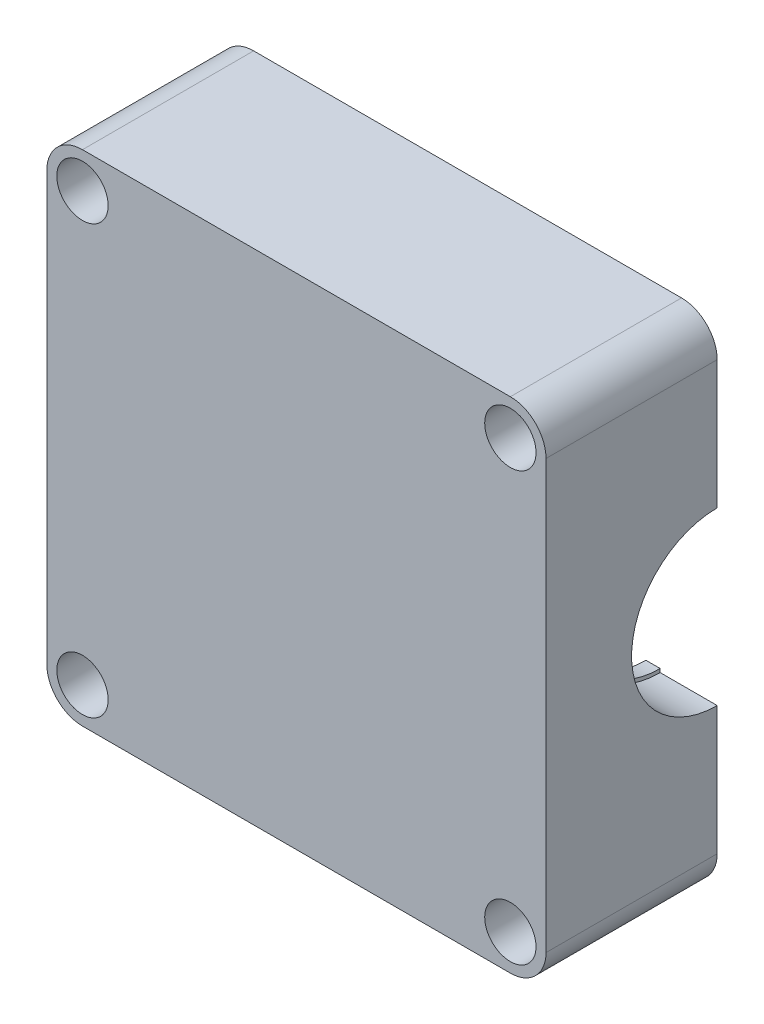
from build123d import *

# Parameters (mm, degrees)
SKETCH_1_R          = 1.8
EXTRUDE_1_DEPTH     = 42
SKETCH_2_R          = 6
CUT_EXTRUDE_1_DEPTH = 58.404268134
SKETCH_3_R          = 6
CUT_EXTRUDE_2_DEPTH = 58.404268134
CUT_EXTRUDE_3_DEPTH = 58.404268134
EXTRUDE_2_DEPTH     = 2.1
EXTRUDE_3_DEPTH     = 1
EXTRUDE_START       = -2
EXTRUDE_4_DEPTH     = 2
SKETCH_8_R          = 1.503070462
SKETCH_8_R_2        = 1.5
CUT_EXTRUDE_4_DEPTH = 3


with BuildPart() as part:
    # 草图1 → 凸台-拉伸1 (new body)
    with BuildSketch(Plane(origin=(0, 0, 0), x_dir=(-1, 0, 0), z_dir=(0, 0, 1))):
        with BuildLine():
            Line((-17.5, 15), (-17.5, -15))
            ThreePointArc((-17.5, -15), (-16.767766953, -16.767766953), (-15, -17.5))
            Line((-15, -17.5), (15, -17.5))
            ThreePointArc((15, -17.5), (16.767766953, -16.767766953), (17.5, -15))
            Line((17.5, -15), (17.5, 15))
            ThreePointArc((17.5, 15), (16.767766953, 16.767766953), (15, 17.5))
            Line((15, 17.5), (-15, 17.5))
            ThreePointArc((-15, 17.5), (-16.767766953, 16.767766953), (-17.5, 15))
        make_face()
        with Locations((-15, -15)):
            Circle(SKETCH_1_R, mode=Mode.SUBTRACT)
        with Locations((15, -15)):
            Circle(SKETCH_1_R, mode=Mode.SUBTRACT)
        with Locations((15, 15)):
            Circle(SKETCH_1_R, mode=Mode.SUBTRACT)
        with Locations((-15, 15)):
            Circle(SKETCH_1_R, mode=Mode.SUBTRACT)
        with BuildLine():
            Line((15.604722414, -11.417049415), (15.604722414, 11.417049415))
            ThreePointArc((15.604722414, 11.417049415), (15.349600754, 12.084241863), (14.71440494, 12.410981979))
            ThreePointArc((14.71440494, 12.410981979), (13.158183899, 13.158182338), (12.410982221, 14.714402746))
            ThreePointArc((12.410982221, 14.714402746), (12.084242685, 15.349600017), (11.417049415, 15.604722414))
            Line((11.417049415, 15.604722414), (-11.417049415, 15.604722414))
            ThreePointArc((-11.417049415, 15.604722414), (-12.084241863, 15.349600754), (-12.410981979, 14.71440494))
            ThreePointArc((-12.410981979, 14.71440494), (-13.158182338, 13.158183899), (-14.714402746, 12.410982221))
            ThreePointArc((-14.714402746, 12.410982221), (-15.349600017, 12.084242685), (-15.604722413, 11.417049415))
            Line((-15.604722413, 11.417049415), (-15.604722413, -11.417049415))
            ThreePointArc((-15.604722413, -11.417049415), (-15.349600754, -12.084241863), (-14.71440494, -12.410981979))
            ThreePointArc((-14.71440494, -12.410981979), (-13.158183899, -13.158182338), (-12.410982221, -14.714402746))
            ThreePointArc((-12.410982221, -14.714402746), (-12.084242685, -15.349600017), (-11.417049415, -15.604722413))
            Line((-11.417049415, -15.604722413), (11.417049415, -15.604722413))
            ThreePointArc((11.417049415, -15.604722413), (12.084241863, -15.349600754), (12.410981979, -14.71440494))
            ThreePointArc((12.410981979, -14.71440494), (13.158182338, -13.158183899), (14.714402746, -12.410982221))
            ThreePointArc((14.714402746, -12.410982221), (15.349600017, -12.084242685), (15.604722414, -11.417049415))
        make_face(mode=Mode.SUBTRACT)
    extrude(amount=EXTRUDE_1_DEPTH)

    # 草图2 → 切除-拉伸1 (cut, through all)
    with BuildSketch(Plane(origin=(0, 17.5, 0), x_dir=(1, 0, 0), z_dir=(0, 1, 0))):
        with Locations(Location((0, -12, 0), (0, 0, 270))):
            Circle(SKETCH_2_R)
    extrude(amount=-CUT_EXTRUDE_1_DEPTH, mode=Mode.SUBTRACT)

    # 草图3 → 切除-拉伸2 (cut, through all)
    with BuildSketch(Plane.ZY.offset(17.5)):
        with Locations((30, 0)):
            Circle(SKETCH_3_R)
    extrude(amount=-CUT_EXTRUDE_2_DEPTH, mode=Mode.SUBTRACT)

    # 草图4 → 切除-拉伸3 (cut, through all)
    with BuildSketch(Plane(origin=(17.5, 0, 0), x_dir=(0, 0, -1), z_dir=(1, 0, 0))):
        Polygon((-30, 6), (-30, -18.57864904), (7.937077404, -18.57864904), (5.133649544, 19.10132203), (-30, 19.10132203), align=None)
    extrude(amount=-CUT_EXTRUDE_3_DEPTH, mode=Mode.SUBTRACT)

    # 草图5 → 凸台-拉伸2 (add)
    with BuildSketch(Plane(origin=(-15.604722414, 0, 0), x_dir=(0, 0, -1), z_dir=(1, 0, 0))):
        with BuildLine():
            Line((-30, -6.5), (-30, -6))
            ThreePointArc((-30, -6), (-36, 0), (-30, 6))
            Line((-30, 6), (-30, 6.5))
            ThreePointArc((-30, 6.5), (-36.5, 0), (-30, -6.5))
        make_face()
    extrude_2 = extrude(amount=EXTRUDE_2_DEPTH)

    # 草图6 → 凸台-拉伸3 (add)
    with BuildSketch(Plane(origin=(-13.504722414, 0, 0), x_dir=(0, 0, -1), z_dir=(1, 0, 0))):
        with BuildLine():
            Line((-30, -6.5), (-30, -5.75))
            ThreePointArc((-30, -5.75), (-35.75, 0), (-30, 5.75))
            Line((-30, 5.75), (-30, 6.5))
            ThreePointArc((-30, 6.5), (-36.5, 0), (-30, -6.5))
        make_face()
    extrude_3 = extrude(amount=EXTRUDE_3_DEPTH)

    # 镜向1: 凸台-拉伸2, 凸台-拉伸3 across plane
    add(extrude_2.mirror(Plane(origin=(0, 0, 0), x_dir=(0, 0, 1), z_dir=(1, 0, 0))))
    add(extrude_3.mirror(Plane(origin=(0, 0, 0), x_dir=(0, 0, 1), z_dir=(1, 0, 0))))

    # 草图7 → 凸台-拉伸4 (add)
    with BuildSketch(Plane.XY.offset(42).offset(EXTRUDE_START)):
        with BuildLine():
            Line((-15.604722414, 11.417049415), (-15.604722414, -11.417049415))
            ThreePointArc((-15.604722414, -11.417049415), (-15.349600754, -12.084241863), (-14.71440494, -12.410981979))
            ThreePointArc((-14.71440494, -12.410981979), (-13.158183899, -13.158182338), (-12.410982221, -14.714402746))
            ThreePointArc((-12.410982221, -14.714402746), (-12.084242685, -15.349600017), (-11.417049415, -15.604722414))
            Line((-11.417049415, -15.604722414), (11.417049415, -15.604722414))
            ThreePointArc((11.417049415, -15.604722414), (12.084241863, -15.349600754), (12.410981979, -14.71440494))
            ThreePointArc((12.410981979, -14.71440494), (13.158182338, -13.158183899), (14.714402746, -12.410982221))
            ThreePointArc((14.714402746, -12.410982221), (15.349600017, -12.084242685), (15.604722413, -11.417049415))
            Line((15.604722413, -11.417049415), (15.604722413, 11.417049415))
            ThreePointArc((15.604722413, 11.417049415), (15.349600754, 12.084241863), (14.71440494, 12.410981979))
            ThreePointArc((14.71440494, 12.410981979), (13.158183899, 13.158182338), (12.410982221, 14.714402746))
            ThreePointArc((12.410982221, 14.714402746), (12.084242685, 15.349600017), (11.417049415, 15.604722413))
            Line((11.417049415, 15.604722413), (-11.417049415, 15.604722413))
            ThreePointArc((-11.417049415, 15.604722413), (-12.084241863, 15.349600754), (-12.410981979, 14.71440494))
            ThreePointArc((-12.410981979, 14.71440494), (-13.158182338, 13.158183899), (-14.714402746, 12.410982221))
            ThreePointArc((-14.714402746, 12.410982221), (-15.349600017, 12.084242685), (-15.604722414, 11.417049415))
        make_face()
    extrude(amount=EXTRUDE_4_DEPTH)

    # 草图8 → 切除-拉伸4 (cut)
    with BuildSketch(Plane.XZ.offset(17.5)):
        with Locations(Location((10.499999996, 33.500000027, 0), (0, 0, 270))):
            Circle(SKETCH_8_R)
        with Locations(Location((-10.500000004, 33.500000024, 0), (0, 0, 270))):
            Circle(SKETCH_8_R_2)
    extrude(amount=-CUT_EXTRUDE_4_DEPTH, mode=Mode.SUBTRACT)


solid = part.part
